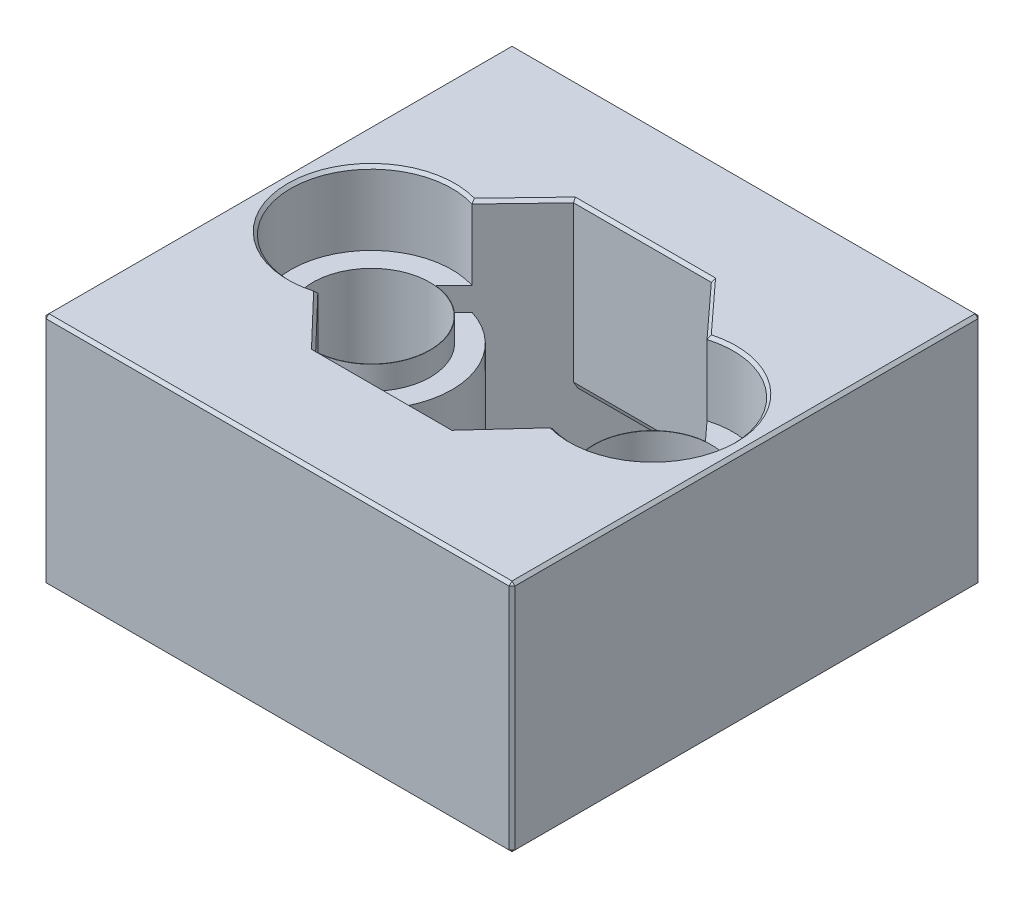
from build123d import *

# Parameters (mm, degrees)
SKETCH1_W                      = 16
SKETCH1_H                      = 16
BOSS_EXTRUDE1_DEPTH            = 8
BOSS_EXTRUDE2_START            = -3.3
BOSS_EXTRUDE2_DEPTH            = 4.7
CBORE_FOR_M3_SHCS1_D           = 4
CBORE_FOR_M3_SHCS1_CBORE_D     = 5.5
CBORE_FOR_M3_SHCS1_CBORE_DEPTH = 2.5
WIRECLEARANCE_SIZE             = 2.5
EDGEBREAK_0_1_SIZE             = 0.1


with BuildPart() as part:
    # Sketch1 → Boss-Extrude1 (new body)
    with BuildSketch(Plane(origin=(0, 0, 0), x_dir=(1, 0, 0), z_dir=(0, 1, 0))):
        Rectangle(SKETCH1_W, SKETCH1_H)
        with BuildLine():
            Line((-4.624026974, -1.974939831), (-2.324025974, -4.374940831))
            Line((-2.324025974, -4.374940831), (2.375974026, -4.374940831))
            Line((2.375974026, -4.374940831), (4.575973243, -1.974939653))
            ThreePointArc((4.575973243, -1.974939653), (2.765999996, 0.025060065), (4.575975026, 2.025058169))
            Line((4.575975026, 2.025058169), (2.375974026, 4.425059169))
            Line((2.375974026, 4.425059169), (-2.324025974, 4.425059169))
            Line((-2.324025974, 4.425059169), (-4.624764746, 2.025131808))
            ThreePointArc((-4.624764746, 2.025131808), (-2.814051979, 0.025429887), (-4.624026974, -1.974939831))
        make_face(mode=Mode.SUBTRACT)
    extrude(amount=-BOSS_EXTRUDE1_DEPTH)

    # Sketch2 → Boss-Extrude2 (add)
    with BuildSketch(Plane(origin=(0, 0, 0), x_dir=(1, 0, 0), z_dir=(0, 1, 0)).offset(BOSS_EXTRUDE2_START)):
        with BuildLine():
            ThreePointArc((3.992847908, -2.611076921), (6.420495716, -2.179038926), (7.525974026, 0.025059169))
            ThreePointArc((7.525974026, 0.025059169), (6.420496186, 2.229156913), (3.992849032, 2.661195592))
            Line((3.992849032, 2.661195592), (4.575975026, 2.025058169))
            ThreePointArc((4.575975026, 2.025058169), (2.765999996, 0.025060065), (4.575973243, -1.974939653))
            Line((4.575973243, -1.974939653), (3.992847908, -2.611076921))
        make_face()
        with BuildLine():
            Line((4.575975026, 2.025058169), (3.992849032, 2.661195592))
            ThreePointArc((3.992849032, 2.661195592), (2.025974026, 0.025059755), (3.992847908, -2.611076921))
            Line((3.992847908, -2.611076921), (4.575973243, -1.974939653))
            ThreePointArc((4.575973243, -1.974939653), (2.765999996, 0.025060065), (4.575975026, 2.025058169))
        make_face()
        with BuildLine():
            ThreePointArc((-4.020334349, -2.604879951), (-2.613522415, -1.610842422), (-2.074025974, 0.025059169))
            ThreePointArc((-2.074025974, 0.025059169), (-2.61366584, 1.661154545), (-4.020795486, 2.655139164))
            Line((-4.020795486, 2.655139164), (-4.624764746, 2.025131808))
            ThreePointArc((-4.624764746, 2.025131808), (-2.814051979, 0.025429887), (-4.624026974, -1.974939831))
            Line((-4.624026974, -1.974939831), (-4.020334349, -2.604879951))
        make_face()
        with BuildLine():
            Line((-4.624764746, 2.025131808), (-4.020795486, 2.655139164))
            ThreePointArc((-4.020795486, 2.655139164), (-7.574025963, 0.024818081), (-4.020334349, -2.604879951))
            Line((-4.020334349, -2.604879951), (-4.624026974, -1.974939831))
            ThreePointArc((-4.624026974, -1.974939831), (-2.814051979, 0.025429887), (-4.624764746, 2.025131808))
        make_face()
    extrude(amount=-BOSS_EXTRUDE2_DEPTH)

    # CBORE for M3 SHCS1 (through all)
    with Locations(Plane(origin=(0, 0, 0), x_dir=(1, 0, 0), z_dir=(0, 1, 0))):
        with Locations((4.775974026, 0.025059169), (-4.824025974, 0.025059169)):
            CounterBoreHole(CBORE_FOR_M3_SHCS1_D / 2, CBORE_FOR_M3_SHCS1_CBORE_D / 2, CBORE_FOR_M3_SHCS1_CBORE_DEPTH)

    # WireClearance
    wireclearance_edges = [part.edges().sort_by_distance(p)[0] for p in [
        (0.025974026, -8, -4.425059169),
        (0.025974026, -8, 4.374940831),
    ]]
    chamfer(wireclearance_edges, length=WIRECLEARANCE_SIZE)

    # Edgebreak-0.1
    edgebreak_0_1_edges = [part.edges().sort_by_distance(p)[0] for p in [
        (-8, -8, 0),
        (0.025974026, -5.5, -4.425059169),
        (0.025974026, -5.5, 4.374940831),
        (0, -8, 8),
        (-1.974073017, -8, -4.790099166),
        (2.038578604, -8, 4.743008876),
        (0.025974026, 0, 4.374940831),
        (3.184410967, 0, 3.493008876),
        (0.025974026, 0, -4.425059169),
        (-3.17241073, 0, -3.540099167),
        (8, -8, 0),
        (2.038578152, -8, -4.793127381),
        (0, 0, 8),
        (-8, 0, 0),
        (0, 0, -8),
        (-1.974263473, -8, 4.739910391),
        (8, 0, 0),
        (0, -8, -8),
        (-3.172180161, 0, 3.489910391),
        (-7.574025963, 0, -0.024818081),
        (8, -4, 8),
        (-8, -4, 8),
        (-8, -4, -8),
        (8, -4, -8),
        (-2.824025974, -8, -0.025059169),
        (3.184411529, 0, -3.543127381),
        (7.525974026, 0, -0.025058583),
        (6.775974026, -8, -0.025059169),
    ]]
    chamfer(edgebreak_0_1_edges, length=EDGEBREAK_0_1_SIZE)


solid = part.part
